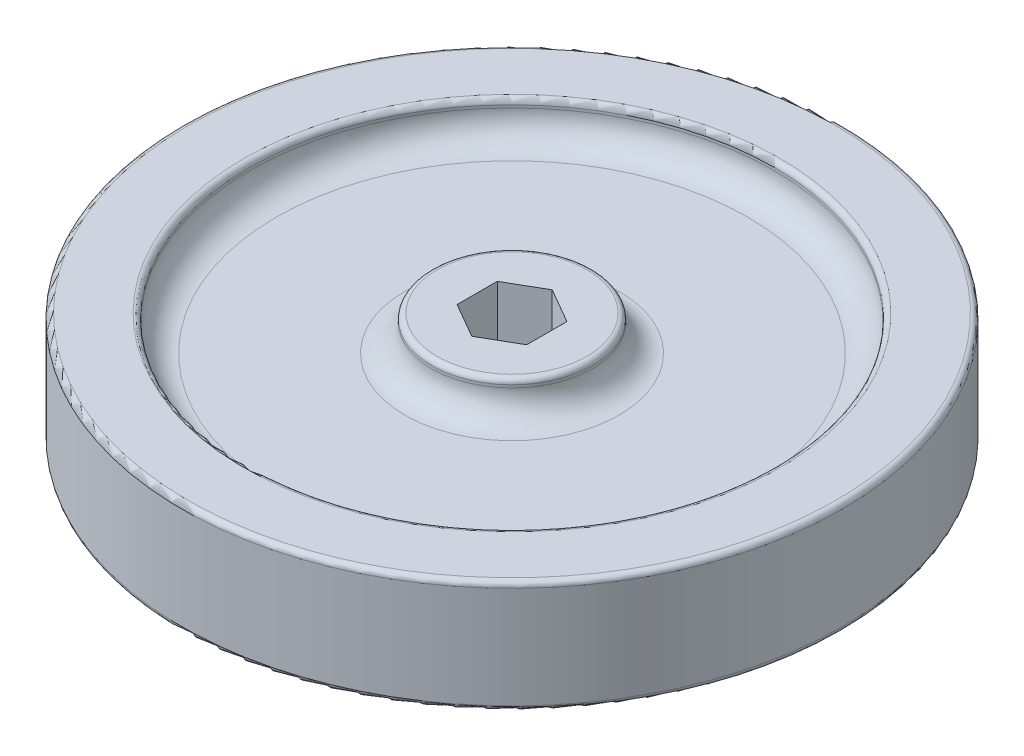
from build123d import *

# Parameters (mm, degrees)
CUT_EXTRUDE1_DEPTH = 90.473459752
FILLET1_R          = 1
FILLET2_R          = 5


with BuildPart() as part:
    # Sketch1 → Revolve1 (revolve)
    with BuildSketch(Plane.XY):
        Polygon((0, 0), (15, 0), (15, 6.5), (49, 6.5), (49, 0), (61.5, 0), (61.5, 21), (49, 21), (49, 14.5), (15, 14.5), (15, 21), (0, 21), align=None)
    revolve(axis=Axis((0, -554.931132677, 0), (0, 1, 0)))

    # Sketch2 → Cut-Extrude1 (cut, through all)
    with BuildSketch(Plane(origin=(0, 21, 0), x_dir=(1, 0, 0), z_dir=(0, 1, 0))):
        Polygon((0, 7.505553499), (-6.5, 3.75277675), (-6.5, -3.75277675), (0, -7.505553499), (6.5, -3.75277675), (6.5, 3.75277675), align=None)
    extrude(amount=-CUT_EXTRUDE1_DEPTH, mode=Mode.SUBTRACT)

    # Fillet1
    fillet1_edges = [part.edges().sort_by_distance(p)[0] for p in [
        (-49, 21, 0),
        (-61.5, 21, 0),
        (-61.5, 0, 0),
        (-49, 0, 0),
        (-15, 0, 0),
        (-15, 21, 0),
    ]]
    fillet(fillet1_edges, radius=FILLET1_R)

    # Fillet2
    fillet2_edges = [part.edges().sort_by_distance(p)[0] for p in [
        (-15, 14.5, 0),
        (-49, 14.5, 0),
        (-49, 6.5, 0),
        (-15, 6.5, 0),
    ]]
    fillet(fillet2_edges, radius=FILLET2_R)


solid = part.part
